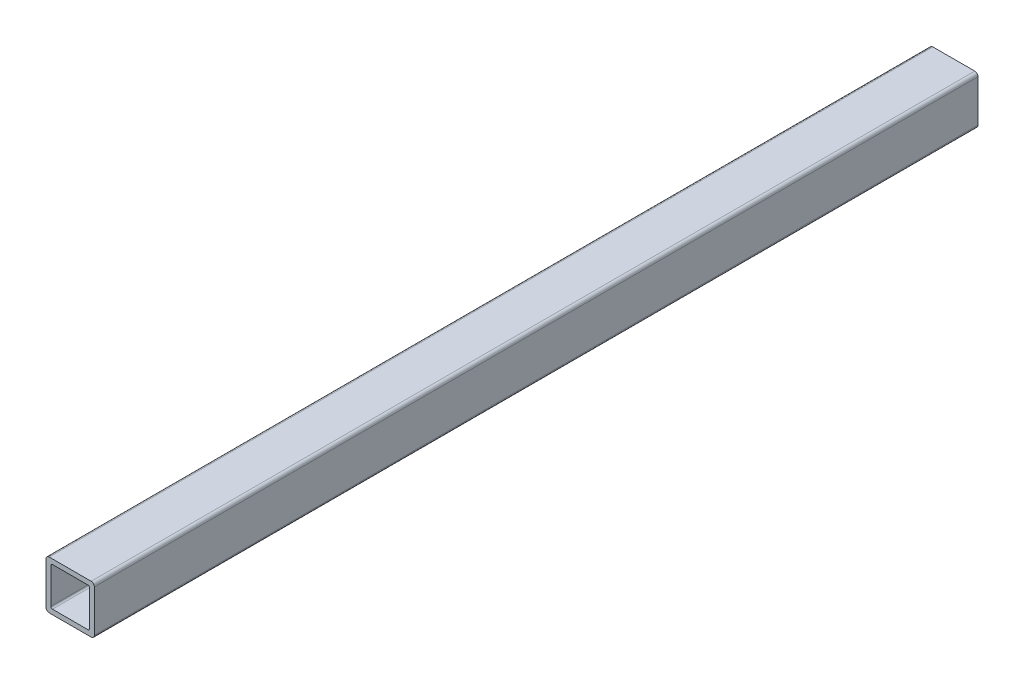
from build123d import *

# Parameters (mm, degrees)
DODANIE_WYCI_GNI_CIE1_DEPTH = 548


with BuildPart() as part:
    # Szkic1 → Dodanie-wyciągnięcie1 (new body)
    with BuildSketch(Plane.XY):
        with BuildLine():
            Line((2, 0), (28, 0))
            ThreePointArc((28, 0), (29.414213562, 0.585786438), (30, 2))
            Line((30, 2), (30, 28))
            ThreePointArc((30, 28), (29.414213562, 29.414213562), (28, 30))
            Line((28, 30), (2, 30))
            ThreePointArc((2, 30), (0.585786438, 29.414213562), (0, 28))
            Line((0, 28), (0, 2))
            ThreePointArc((0, 2), (0.585786438, 0.585786438), (2, 0))
        make_face()
        with BuildLine():
            Line((4, 3), (26, 3))
            ThreePointArc((26, 3), (26.707106781, 3.292893219), (27, 4))
            Line((27, 4), (27, 26))
            ThreePointArc((27, 26), (26.707106781, 26.707106781), (26, 27))
            Line((26, 27), (4, 27))
            ThreePointArc((4, 27), (3.292893219, 26.707106781), (3, 26))
            Line((3, 26), (3, 4))
            ThreePointArc((3, 4), (3.292893219, 3.292893219), (4, 3))
        make_face(mode=Mode.SUBTRACT)
    extrude(amount=DODANIE_WYCI_GNI_CIE1_DEPTH)


solid = part.part
